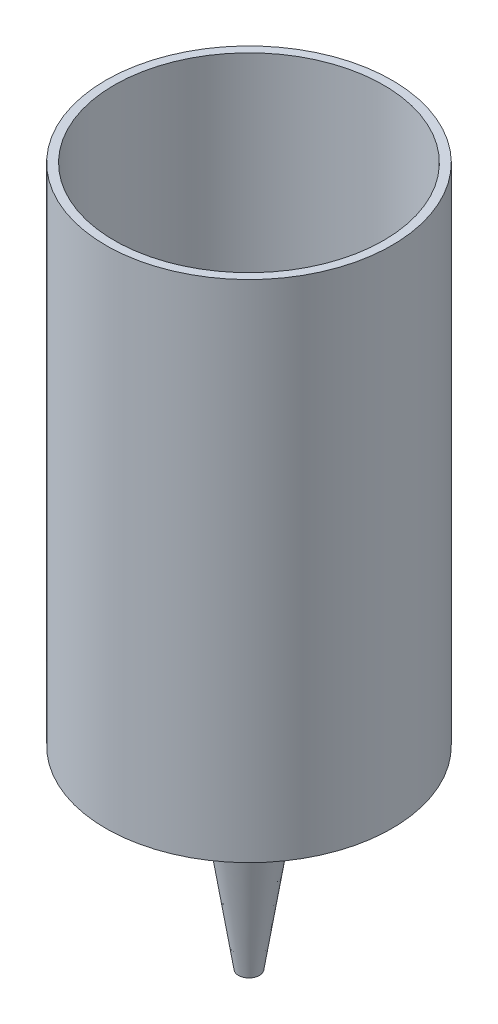
from build123d import *

# Parameters (mm, degrees)
SHELL1_T                = -1.27
CUT_EXTRUDE1_DEPTH      = 110.742992031
CUT_EXTRUDE1_DEPTH_BACK = 110.742992031
SKETCH3_R               = 1.0795


with BuildPart() as part:
    # Sketch1 → Revolve1 (revolve)
    with BuildSketch(Plane.XY):
        Polygon((-5.517444444, 25.4), (-1.5875, 0), (0, 0), (0, 105.41), (-21.59, 105.41), (-21.59, 29.21), align=None)
    revolve(axis=Axis((0, 105.41, 0), (0, -1, 0)))

    # Shell1
    shell1_openings = [part.faces().sort_by_distance(p)[0] for p in [
        (0, 105.41, 0),
    ]]
    offset(amount=SHELL1_T, openings=shell1_openings, kind=Kind.INTERSECTION)

    # Sketch3 → Cut-Extrude1 (cut, two sides: drawn at the far end of the back side and taken through both)
    with BuildSketch(Plane.XZ.offset(-CUT_EXTRUDE1_DEPTH_BACK)):
        Circle(SKETCH3_R)
    extrude(amount=CUT_EXTRUDE1_DEPTH + CUT_EXTRUDE1_DEPTH_BACK, mode=Mode.SUBTRACT)


solid = part.part
